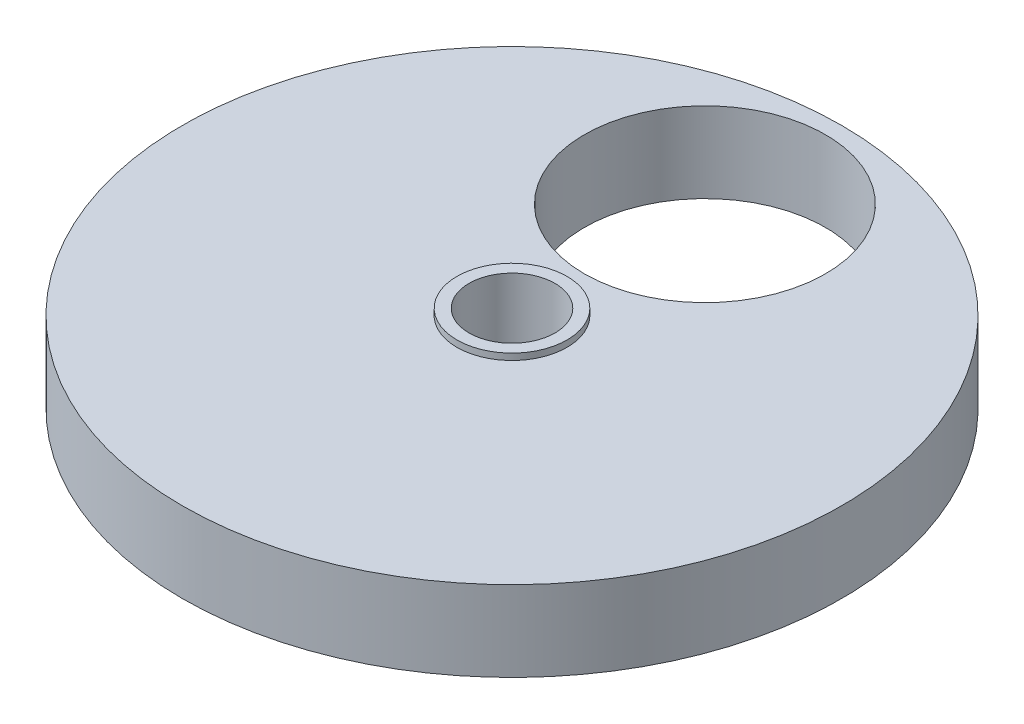
from build123d import *

# Parameters (mm, degrees)
SKETCH1_R           = 20.5
BOSS_EXTRUDE1_DEPTH = 5
SKETCH2_R           = 2.675
CUT_EXTRUDE1_DEPTH  = 5
BOSS_EXTRUDE2_START = 0.4
SKETCH3_R           = 3.425
SKETCH3_R_2         = 2.675
BOSS_EXTRUDE2_DEPTH = 0.4
SKETCH5_R           = 7.5
CUT_EXTRUDE3_DEPTH  = 5


with BuildPart() as part:
    # Sketch1 → Boss-Extrude1 (new body)
    with BuildSketch(Plane(origin=(0, 0, 0), x_dir=(1, 0, 0), z_dir=(0, 1, 0))):
        with Locations(Location((0, 0, 0), (0, 0, 270))):
            Circle(SKETCH1_R)
    extrude(amount=BOSS_EXTRUDE1_DEPTH)

    # Sketch2 → Cut-Extrude1 (cut)
    with BuildSketch(Plane(origin=(0, 5, 0), x_dir=(1, 0, 0), z_dir=(0, 1, 0))):
        with Locations(Location((0, 0, 0), (0, 0, 270))):
            Circle(SKETCH2_R)
    extrude(amount=-CUT_EXTRUDE1_DEPTH, mode=Mode.SUBTRACT)

    # Sketch3 → Boss-Extrude2 (add)
    with BuildSketch(Plane(origin=(0, 5, 0), x_dir=(1, 0, 0), z_dir=(0, 1, 0)).offset(BOSS_EXTRUDE2_START)):
        with Locations(Location((0, 0, 0), (0, 0, 270))):
            Circle(SKETCH3_R)
        with Locations(Location((0, 0, 0), (0, 0, 270))):
            Circle(SKETCH3_R_2, mode=Mode.SUBTRACT)
    extrude(amount=-BOSS_EXTRUDE2_DEPTH)

    # Sketch5 → Cut-Extrude3 (cut)
    with BuildSketch(Plane(origin=(0, 5, 0), x_dir=(1, 0, 0), z_dir=(0, 1, 0))):
        with Locations(Location((0, 12, 0), (0, 0, 270))):
            Circle(SKETCH5_R)
    extrude(amount=-CUT_EXTRUDE3_DEPTH, mode=Mode.SUBTRACT)


solid = part.part
